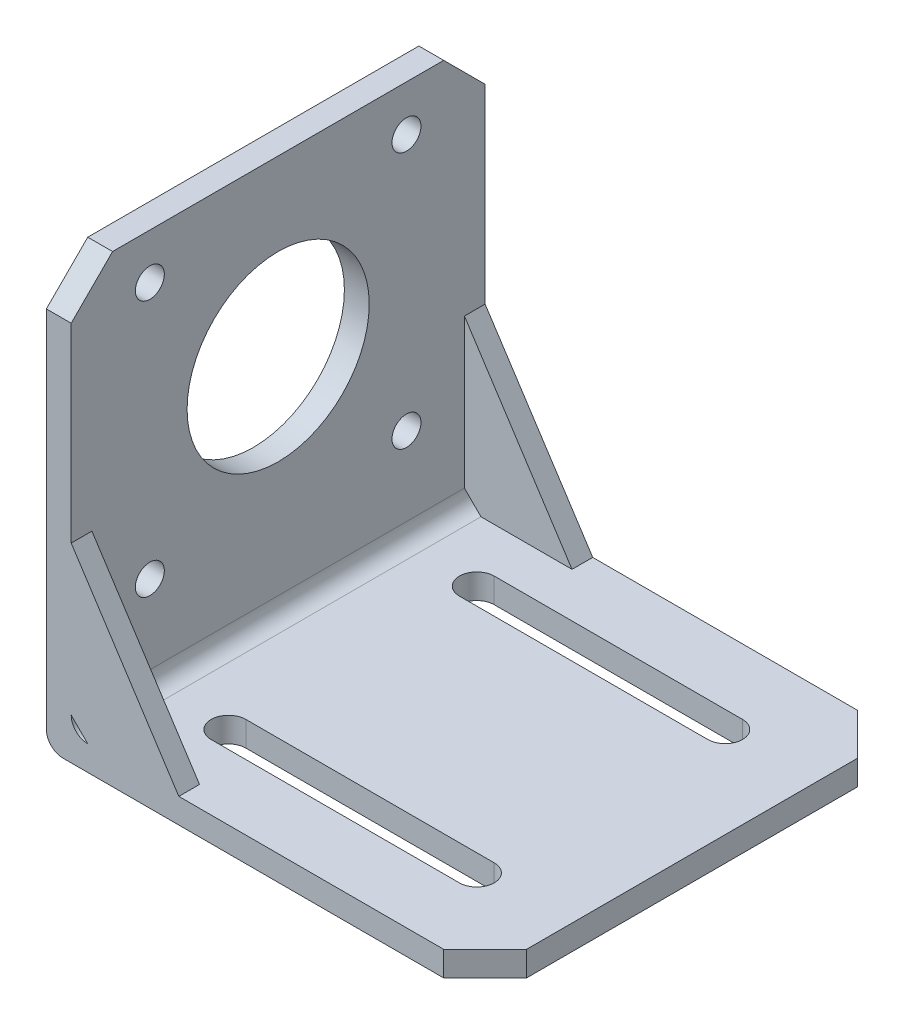
from build123d import *

# Parameters (mm, degrees)
EXTRUDE_1_DEPTH     = 25
CUT_EXTRUDE_1_REACH = 77.67
SKETCH_2_R          = 11
SKETCH_2_R_2        = 1.75
CUT_EXTRUDE_2_REACH = 77.75
CHAMFER_1_SIZE      = 5
FILLET_1_R          = 2
EXTRUDE_2_DEPTH     = 2.5


with BuildPart() as part:
    # 草图1 → 凸台-拉伸1 (new, symmetric)
    with BuildSketch(Plane.XY):
        Polygon((0, 0), (-53, 0), (-53, 51), (-50, 51), (-50, 3), (0, 3), align=None)
    extrude(amount=EXTRUDE_1_DEPTH, both=True)

    # 草图2 → 切除-拉伸1 (cut, up to next)
    with BuildSketch(Plane(origin=(-50, 0, 0), x_dir=(0, 0, -1), z_dir=(1, 0, 0)), mode=Mode.PRIVATE) as cut_extrude_1_sk1:
        with Locations(Location((0, 30, 0), (0, 0, 90))):
            Circle(SKETCH_2_R)
    cut_extrude_1_tool1 = extrude(cut_extrude_1_sk1.sketch, amount=-CUT_EXTRUDE_1_REACH, mode=Mode.PRIVATE) & part.part
    # 草图2 → 切除-拉伸1 (cut, up to next)
    with BuildSketch(Plane(origin=(-50, 0, 0), x_dir=(0, 0, -1), z_dir=(1, 0, 0)), mode=Mode.PRIVATE) as cut_extrude_1_sk2:
        with Locations(Location((-15.5, 45.5, 0), (0, 0, 90))):
            Circle(SKETCH_2_R_2)
    cut_extrude_1_tool2 = extrude(cut_extrude_1_sk2.sketch, amount=-CUT_EXTRUDE_1_REACH, mode=Mode.PRIVATE) & part.part
    # 草图2 → 切除-拉伸1 (cut, up to next)
    with BuildSketch(Plane(origin=(-50, 0, 0), x_dir=(0, 0, -1), z_dir=(1, 0, 0)), mode=Mode.PRIVATE) as cut_extrude_1_sk3:
        with Locations(Location((15.5, 45.5, 0), (0, 0, 90))):
            Circle(SKETCH_2_R_2)
    cut_extrude_1_tool3 = extrude(cut_extrude_1_sk3.sketch, amount=-CUT_EXTRUDE_1_REACH, mode=Mode.PRIVATE) & part.part
    # 草图2 → 切除-拉伸1 (cut, up to next)
    with BuildSketch(Plane(origin=(-50, 0, 0), x_dir=(0, 0, -1), z_dir=(1, 0, 0)), mode=Mode.PRIVATE) as cut_extrude_1_sk4:
        with Locations(Location((-15.5, 14.5, 0), (0, 0, 90))):
            Circle(SKETCH_2_R_2)
    cut_extrude_1_tool4 = extrude(cut_extrude_1_sk4.sketch, amount=-CUT_EXTRUDE_1_REACH, mode=Mode.PRIVATE) & part.part
    # 草图2 → 切除-拉伸1 (cut, up to next)
    with BuildSketch(Plane(origin=(-50, 0, 0), x_dir=(0, 0, -1), z_dir=(1, 0, 0)), mode=Mode.PRIVATE) as cut_extrude_1_sk5:
        with Locations(Location((15.5, 14.5, 0), (0, 0, 90))):
            Circle(SKETCH_2_R_2)
    cut_extrude_1_tool5 = extrude(cut_extrude_1_sk5.sketch, amount=-CUT_EXTRUDE_1_REACH, mode=Mode.PRIVATE) & part.part
    add(cut_extrude_1_tool1.solids().sort_by_distance((-50, 30, 0))[0], mode=Mode.SUBTRACT)
    add(cut_extrude_1_tool2.solids().sort_by_distance((-50, 45.5, 15.5))[0], mode=Mode.SUBTRACT)
    add(cut_extrude_1_tool3.solids().sort_by_distance((-50, 45.5, -15.5))[0], mode=Mode.SUBTRACT)
    add(cut_extrude_1_tool4.solids().sort_by_distance((-50, 14.5, 15.5))[0], mode=Mode.SUBTRACT)
    add(cut_extrude_1_tool5.solids().sort_by_distance((-50, 14.5, -15.5))[0], mode=Mode.SUBTRACT)

    # 草图3 → 切除-拉伸2 (cut, up to next)
    with BuildSketch(Plane(origin=(0, 3, 0), x_dir=(1, 0, 0), z_dir=(0, 1, 0)), mode=Mode.PRIVATE) as cut_extrude_2_sk1:
        with BuildLine():
            Line((-41, 17.1), (-11, 17.1))
            ThreePointArc((-11, 17.1), (-8.9, 15), (-11, 12.9))
            Line((-11, 12.9), (-41, 12.9))
            ThreePointArc((-41, 12.9), (-43.1, 15), (-41, 17.1))
        make_face()
    cut_extrude_2_tool1 = extrude(cut_extrude_2_sk1.sketch, amount=-CUT_EXTRUDE_2_REACH, mode=Mode.PRIVATE) & part.part
    # 草图3 → 切除-拉伸2 (cut, up to next)
    with BuildSketch(Plane(origin=(0, 3, 0), x_dir=(1, 0, 0), z_dir=(0, 1, 0)), mode=Mode.PRIVATE) as cut_extrude_2_sk2:
        with BuildLine():
            Line((-41, -12.9), (-11, -12.9))
            ThreePointArc((-11, -12.9), (-8.9, -15), (-11, -17.1))
            Line((-11, -17.1), (-41, -17.1))
            ThreePointArc((-41, -17.1), (-43.1, -15), (-41, -12.9))
        make_face()
    cut_extrude_2_tool2 = extrude(cut_extrude_2_sk2.sketch, amount=-CUT_EXTRUDE_2_REACH, mode=Mode.PRIVATE) & part.part
    add(cut_extrude_2_tool1.solids().sort_by_distance((-26, 3, -15))[0], mode=Mode.SUBTRACT)
    add(cut_extrude_2_tool2.solids().sort_by_distance((-26, 3, 15))[0], mode=Mode.SUBTRACT)

    # 倒角1
    chamfer_1_edges = [part.edges().sort_by_distance(p)[0] for p in [
        (-51.5, 51, 25),
        (0, 1.5, 25),
        (-51.5, 51, -25),
        (0, 1.5, -25),
    ]]
    chamfer(chamfer_1_edges, length=CHAMFER_1_SIZE)

    # 圆角1
    fillet_1_edges = [part.edges().sort_by_distance(p)[0] for p in [
        (-53, 0, 0),
        (-50, 3, 0),
    ]]
    fillet(fillet_1_edges, radius=FILLET_1_R)

    # 草图4 → 凸台-拉伸2 (add)
    with BuildSketch(Plane.XY.offset(25)):
        Polygon((-50, 23), (-50, 5), (-48, 3), (-37, 3), align=None)
    extrude_2 = extrude(amount=-EXTRUDE_2_DEPTH)

    # 镜向1: 凸台-拉伸2 across plane
    add(extrude_2.mirror(Plane.XY))


solid = part.part
